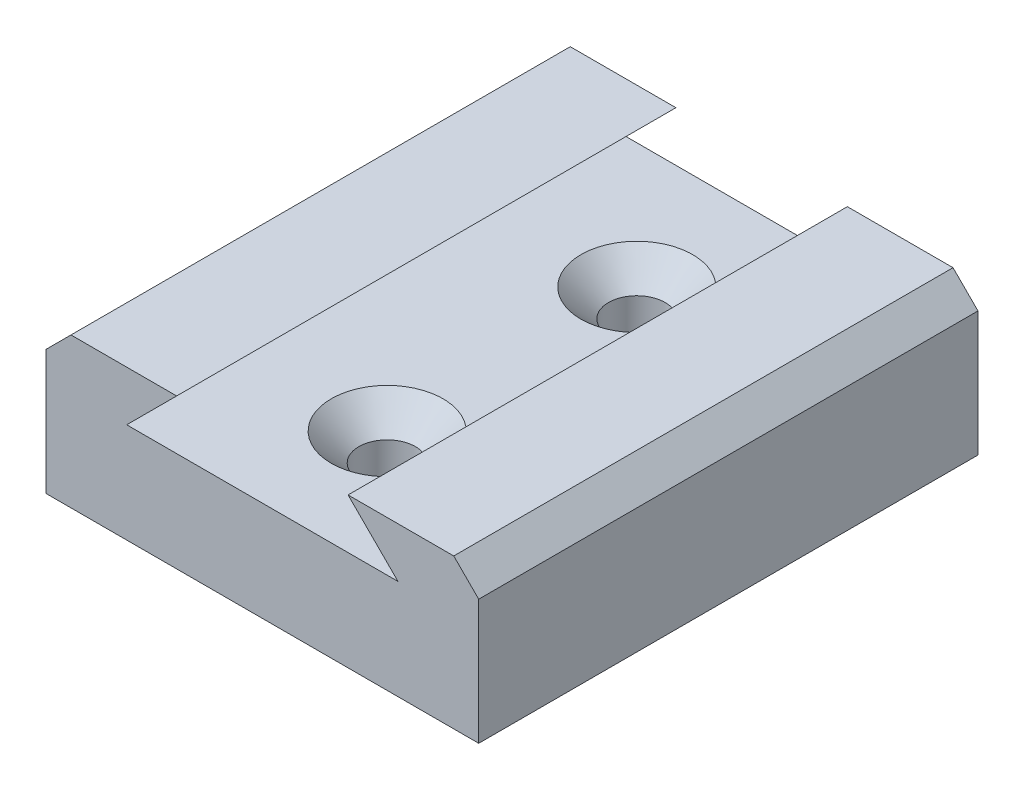
from build123d import *

# Parameters (mm, degrees)
BOSS_EXTRUDE1_DEPTH                                  = 30
CSK_FOR_M3_HEX_SOCKET_COUNTERSUNK_CAP_SC_D           = 3.4
CSK_FOR_M3_HEX_SOCKET_COUNTERSUNK_CAP_SC_CSINK_D     = 6.72
CSK_FOR_M3_HEX_SOCKET_COUNTERSUNK_CAP_SC_CSINK_ANGLE = 90


with BuildPart() as part:
    # Sketch2 → Boss-Extrude1 (new body)
    with BuildSketch(Plane.XY):
        Polygon((-13, 0), (13, 0), (13, 7.5), (11.5, 9), (5.15, 9), (8.15, 6), (-8.15, 6), (-5.15, 9), (-11.5, 9), (-13, 7.5), align=None)
    extrude(amount=BOSS_EXTRUDE1_DEPTH)

    # CSK for M3 Hex Socket Countersunk Cap Screw2 (through all)
    with Locations(Plane(origin=(0, 6, 0), x_dir=(1, 0, 0), z_dir=(0, 1, 0))):
        with Locations((0, -7.5), (0, -22.5)):
            CounterSinkHole(CSK_FOR_M3_HEX_SOCKET_COUNTERSUNK_CAP_SC_D / 2, CSK_FOR_M3_HEX_SOCKET_COUNTERSUNK_CAP_SC_CSINK_D / 2, counter_sink_angle=CSK_FOR_M3_HEX_SOCKET_COUNTERSUNK_CAP_SC_CSINK_ANGLE)


solid = part.part
